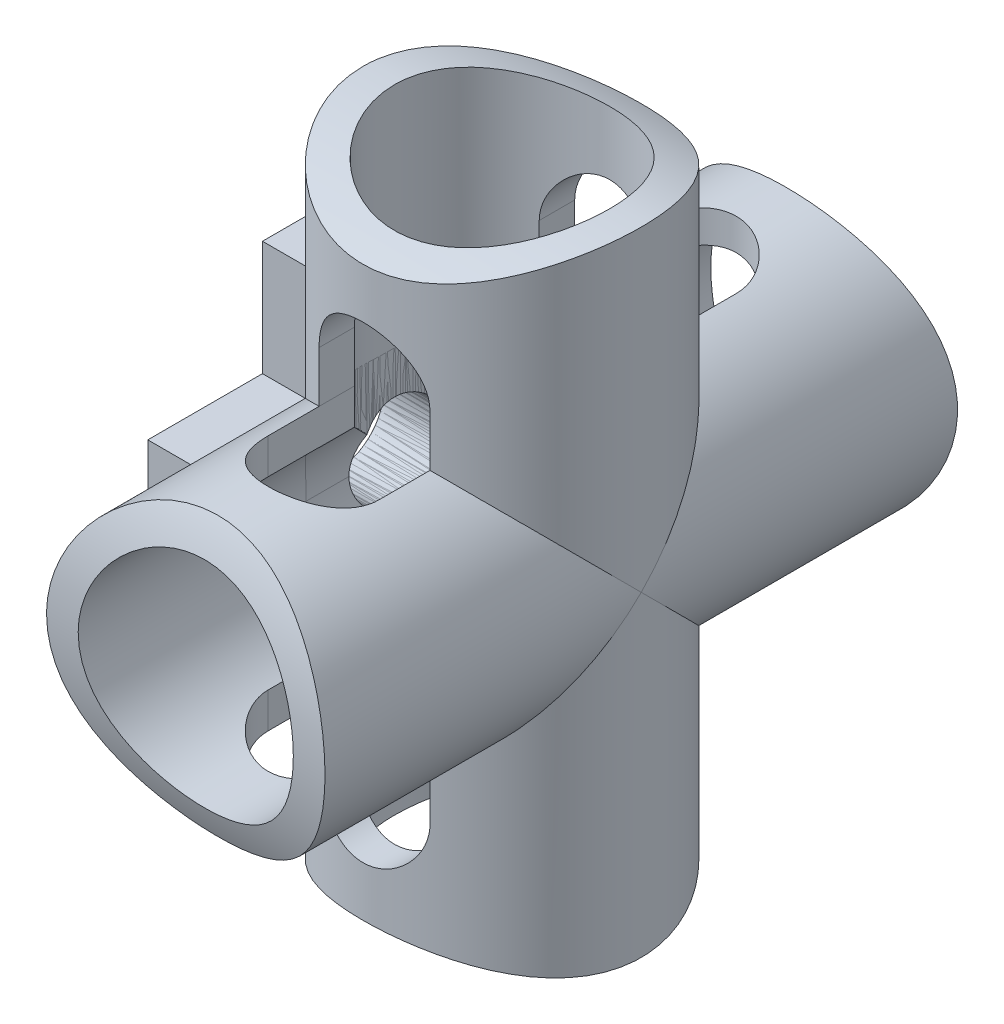
from build123d import *

# Parameters (mm, degrees)
BOSS_EXTRUDE1_DEPTH      = 45.72
BOSS_EXTRUDE1_DEPTH_BACK = 2.54
SKETCH1_R                = 11.176
SKETCH1_R_2              = 8.636
SKETCH2_R                = 10.668
BOSS_EXTRUDE2_DEPTH      = 2.032
CUT_EXTRUDE1_DEPTH       = 49.374831803
CUT_EXTRUDE1_DEPTH_BACK  = 49.374831803
CUT_EXTRUDE2_REACH       = 52.782
SKETCH4_R                = 4.445
BOSS_EXTRUDE3_DEPTH      = 2.032
BOSS_EXTRUDE3_DEPTH_BACK = 2.54
SKETCH5_W                = 12.065
SKETCH5_H                = 30.48
SKETCH6_R                = 3.683
CUT_EXTRUDE3_DEPTH       = 2.286
CUT_EXTRUDE4_DEPTH       = 54.007554634
FILLET1_R                = 2.54
SKETCH13_W               = 34.783224987
SKETCH13_H               = 27.791912324
CUT_EXTRUDE7_DEPTH       = 31.732950514
CIRPATTERN2_COUNT        = 4
CUT_EXTRUDE8_DEPTH       = 57.112733659
CUT_EXTRUDE8_DEPTH_BACK  = 57.112733659
SKETCH15_R               = 8.636
SKETCH16_R               = 3.683
CUT_EXTRUDE9_DEPTH       = 8.778233
CUT_EXTRUDE10_DEPTH      = 57.112733683
CUT_EXTRUDE10_DEPTH_BACK = 57.112733683
SKETCH17_R               = 8.616569702


with BuildPart() as part:
    # Sketch1 → Boss-Extrude1 (new, two sides: drawn at the far end of the back side and taken through both)
    with BuildSketch(Plane(origin=(0, 0, 0), x_dir=(1, 0, 0), z_dir=(0, 1, 0)).offset(-BOSS_EXTRUDE1_DEPTH_BACK)):
        with Locations(Location((0, 0, 0), (0, 0, 270))):
            Circle(SKETCH1_R)
        with Locations(Location((0, 0, 0), (0, 0, 270))):
            Circle(SKETCH1_R_2, mode=Mode.SUBTRACT)
    extrude(amount=BOSS_EXTRUDE1_DEPTH + BOSS_EXTRUDE1_DEPTH_BACK)

    # Sketch2 → Boss-Extrude2 (add)
    with BuildSketch(Plane(origin=(0, 45.72, 0), x_dir=(1, 0, 0), z_dir=(0, 1, 0))):
        Circle(SKETCH2_R)
    extrude(amount=-BOSS_EXTRUDE2_DEPTH)

    # Sketch3 → Cut-Extrude1 (cut, two sides: drawn at the far end of the back side and taken through both)
    with BuildSketch(Plane.XY.offset(-CUT_EXTRUDE1_DEPTH_BACK)):
        with BuildLine():
            Line((4.429766635, 37.211), (4.429766635, 29.336942899))
            ThreePointArc((4.429766635, 29.336942899), (-0.015233365, 24.891942899), (-4.460233365, 29.336942899))
            Line((-4.460233365, 29.336942899), (-4.460233365, 37.211))
            ThreePointArc((-4.460233365, 37.211), (-0.015233365, 41.656), (4.429766635, 37.211))
        make_face()
        with BuildLine():
            Line((-4.429766635, 8.509), (-4.429766635, 16.383057101))
            ThreePointArc((-4.429766635, 16.383057101), (0.015233365, 20.828057101), (4.460233365, 16.383057101))
            Line((4.460233365, 16.383057101), (4.460233365, 8.509))
            ThreePointArc((4.460233365, 8.509), (0.015233365, 4.064), (-4.429766635, 8.509))
        make_face()
    extrude(amount=CUT_EXTRUDE1_DEPTH + CUT_EXTRUDE1_DEPTH_BACK, mode=Mode.SUBTRACT)

    # Sketch4 → Cut-Extrude2 (cut, up to next)
    with BuildSketch(Plane(origin=(0, 45.72, 0), x_dir=(1, 0, 0), z_dir=(0, 1, 0)), mode=Mode.PRIVATE) as cut_extrude2_sk1:
        with Locations(Location((0, 0, 0), (0, 0, 270))):
            Circle(SKETCH4_R)
    cut_extrude2_tool1 = extrude(cut_extrude2_sk1.sketch, amount=-CUT_EXTRUDE2_REACH, mode=Mode.PRIVATE) & part.part
    add(cut_extrude2_tool1.solids().sort_by_distance((0, 45.72, 0))[0], mode=Mode.SUBTRACT)

    # Sketch5 → Boss-Extrude3 (add, two sides: drawn at the far end of the back side and taken through both)
    with BuildSketch(Plane(origin=(-10.668, 0, 0), x_dir=(0, 0, -1), z_dir=(1, 0, 0)).offset(-BOSS_EXTRUDE3_DEPTH_BACK)):
        with Locations((0, 22.86)):
            Rectangle(SKETCH5_W, SKETCH5_H)
    extrude(amount=BOSS_EXTRUDE3_DEPTH + BOSS_EXTRUDE3_DEPTH_BACK)

    # Sketch6 → Cut-Extrude3 (cut)
    with BuildSketch(Plane.ZY.offset(13.208)):
        with Locations((0, 22.86)):
            Circle(SKETCH6_R)
    extrude(amount=-CUT_EXTRUDE3_DEPTH, mode=Mode.SUBTRACT)

    # Sketch8 → Cut-Extrude4 (cut, through all)
    with BuildSketch(Plane.ZY.offset(13.208)):
        with BuildLine():
            Line((-13.894688237, -6.768770079), (13.894688237, -6.768770079))
            Line((13.894688237, -6.768770079), (13.894688237, 1.597412227))
            ThreePointArc((13.894688237, 1.597412227), (0, -2.54), (-13.894688237, 1.597412227))
            Line((-13.894688237, 1.597412227), (-13.894688237, -6.768770079))
        make_face()
    extrude(amount=-CUT_EXTRUDE4_DEPTH, mode=Mode.SUBTRACT)

    # Fillet1
    fillet1_edges = [part.edges().sort_by_distance(p)[0] for p in [
        (0, 45.72, -11.176),
    ]]
    fillet(fillet1_edges, radius=FILLET1_R)

    # Sketch13 → Cut-Extrude7 (cut, through all)
    with BuildSketch(Plane(origin=(0, 22.86, 0), x_dir=(1, 0, 0), z_dir=(0, 1, 0))):
        with Locations((-1.039390936, 0.722243044)):
            Rectangle(SKETCH13_W, SKETCH13_H)
    extrude(amount=CUT_EXTRUDE7_DEPTH, mode=Mode.SUBTRACT)


with BuildPart() as cirpattern2_1:
    # CirPattern2: pattern copy
    add(part.part.rotate(Axis((0, 22.86, 0), (1, 0, 0)), 1 * 360 / CIRPATTERN2_COUNT))


with BuildPart() as cirpattern2_2:
    # CirPattern2: pattern copy
    add(part.part.rotate(Axis((0, 22.86, 0), (1, 0, 0)), 2 * 360 / CIRPATTERN2_COUNT))


with BuildPart() as cirpattern2_3:
    # CirPattern2: pattern copy
    add(part.part.rotate(Axis((0, 22.86, 0), (1, 0, 0)), 3 * 360 / CIRPATTERN2_COUNT))


with BuildPart() as cut_extrude8_tool:
    # Sketch15 → Cut-Extrude8 (new, two sides: drawn at the far end of the back side and taken through both)
    with BuildSketch(Plane(origin=(0, 0, 0), x_dir=(1, 0, 0), z_dir=(0, 1, 0)).offset(-CUT_EXTRUDE8_DEPTH_BACK)):
        with Locations(Location((0, 0, 0), (0, 0, 90))):
            Circle(SKETCH15_R)
    extrude(amount=CUT_EXTRUDE8_DEPTH + CUT_EXTRUDE8_DEPTH_BACK)


with BuildPart() as cirpattern2_1_1:
    add(cirpattern2_1.part)

    # Cut-Extrude8: cut by cut_extrude8_tool
    add(cut_extrude8_tool.part, mode=Mode.SUBTRACT)


with BuildPart() as cirpattern2_3_1:
    add(cirpattern2_3.part)

    # Cut-Extrude8: cut by cut_extrude8_tool
    add(cut_extrude8_tool.part, mode=Mode.SUBTRACT)


with BuildPart() as cut_extrude9_tool:
    # Sketch16 → Cut-Extrude9 (new body)
    with BuildSketch(Plane.ZY.offset(13.208)):
        with Locations((0, 22.86)):
            Circle(SKETCH16_R)
    extrude(amount=-CUT_EXTRUDE9_DEPTH)


with BuildPart() as part_1:
    add(part.part)

    # Cut-Extrude9: cut by cut_extrude9_tool
    add(cut_extrude9_tool.part, mode=Mode.SUBTRACT)


with BuildPart() as cirpattern2_1_2:
    add(cirpattern2_1_1.part)

    # Cut-Extrude9: cut by cut_extrude9_tool
    add(cut_extrude9_tool.part, mode=Mode.SUBTRACT)


with BuildPart() as cirpattern2_2_1:
    add(cirpattern2_2.part)

    # Cut-Extrude9: cut by cut_extrude9_tool
    add(cut_extrude9_tool.part, mode=Mode.SUBTRACT)


with BuildPart() as cirpattern2_3_2:
    add(cirpattern2_3_1.part)

    # Cut-Extrude9: cut by cut_extrude9_tool
    add(cut_extrude9_tool.part, mode=Mode.SUBTRACT)


with BuildPart() as cut_extrude10_tool:
    # Sketch17 → Cut-Extrude10 (new, two sides: drawn at the far end of the back side and taken through both)
    with BuildSketch(Plane.XY.offset(-CUT_EXTRUDE10_DEPTH_BACK)):
        with Locations((0, 22.86)):
            Circle(SKETCH17_R)
    extrude(amount=CUT_EXTRUDE10_DEPTH + CUT_EXTRUDE10_DEPTH_BACK)


with BuildPart() as part_2:
    add(part_1.part)

    # Cut-Extrude10: cut by cut_extrude10_tool
    add(cut_extrude10_tool.part, mode=Mode.SUBTRACT)


with BuildPart() as cirpattern2_2_2:
    add(cirpattern2_2_1.part)

    # Cut-Extrude10: cut by cut_extrude10_tool
    add(cut_extrude10_tool.part, mode=Mode.SUBTRACT)


solid = Compound([cirpattern2_1_2.part, cirpattern2_3_2.part, part_2.part, cirpattern2_2_2.part])
